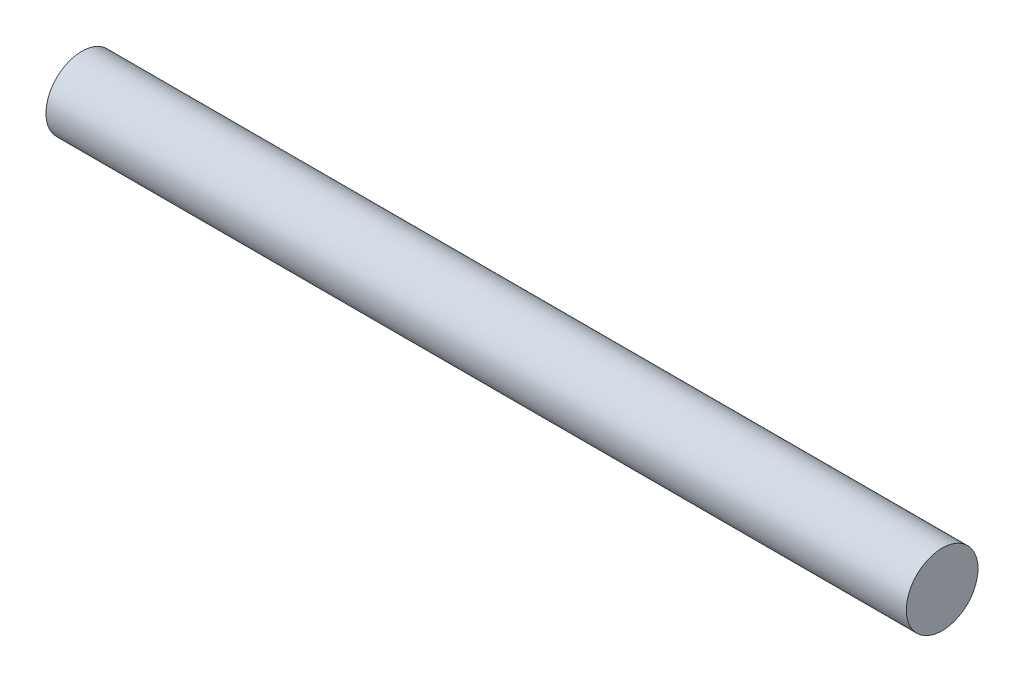
from build123d import *

# Parameters (mm, degrees)
SKETCH2_R           = 1.5
BOSS_EXTRUDE1_DEPTH = 36


with BuildPart() as part:
    # Sketch2 → Boss-Extrude1 (new body)
    with BuildSketch(Plane(origin=(0, 0, 0), x_dir=(0, 0, -1), z_dir=(1, 0, 0))):
        Circle(SKETCH2_R)
    extrude(amount=BOSS_EXTRUDE1_DEPTH)


solid = part.part
